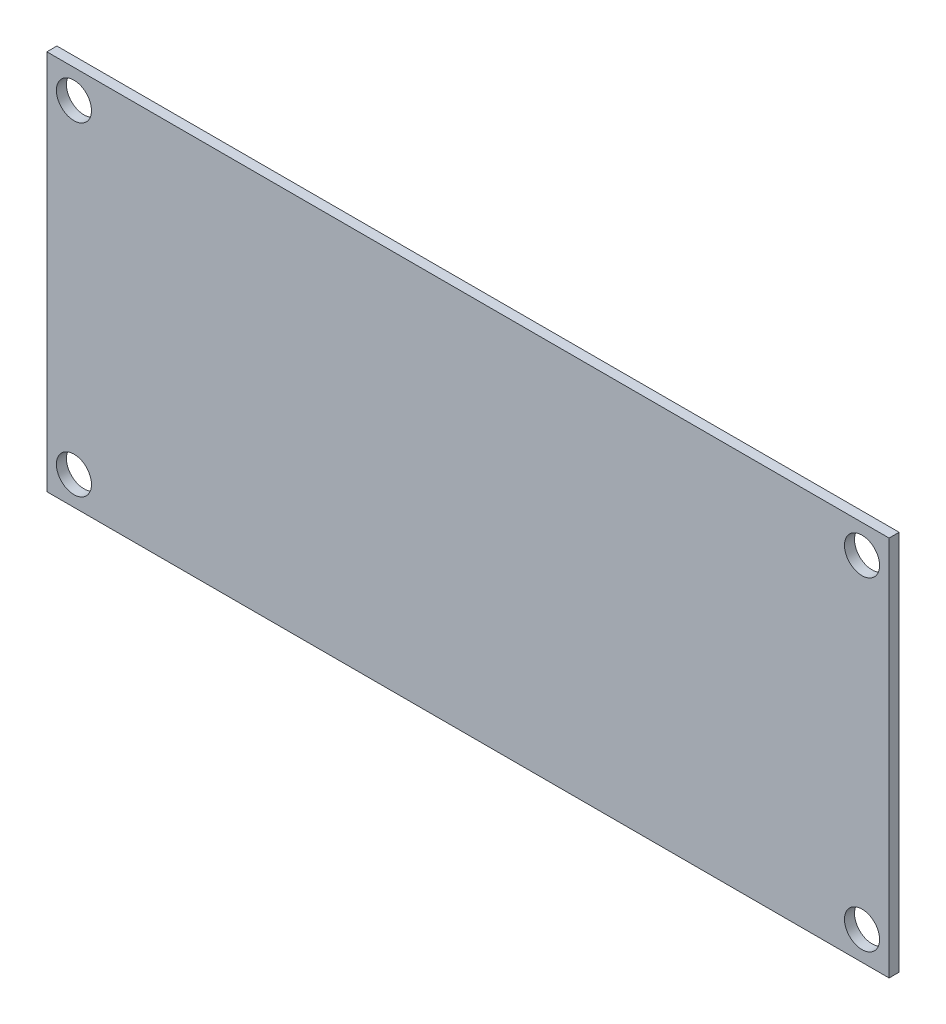
from build123d import *

# Parameters (mm, degrees)
ESBO_O1_W                = 84
ESBO_O1_H                = 38
ESBO_O1_R                = 1.75
RESSALTO_EXTRUS_O1_DEPTH = 1


with BuildPart() as part:
    # Esboço1 → Ressalto-extrusão1 (new body)
    with BuildSketch(Plane.XY):
        Rectangle(ESBO_O1_W, ESBO_O1_H)
        with Locations((-39.3, 16.15)):
            Circle(ESBO_O1_R, mode=Mode.SUBTRACT)
        with Locations((39.3, 16.15)):
            Circle(ESBO_O1_R, mode=Mode.SUBTRACT)
        with Locations((-39.3, -16.15)):
            Circle(ESBO_O1_R, mode=Mode.SUBTRACT)
        with Locations((39.3, -16.15)):
            Circle(ESBO_O1_R, mode=Mode.SUBTRACT)
    extrude(amount=RESSALTO_EXTRUS_O1_DEPTH)


solid = part.part
